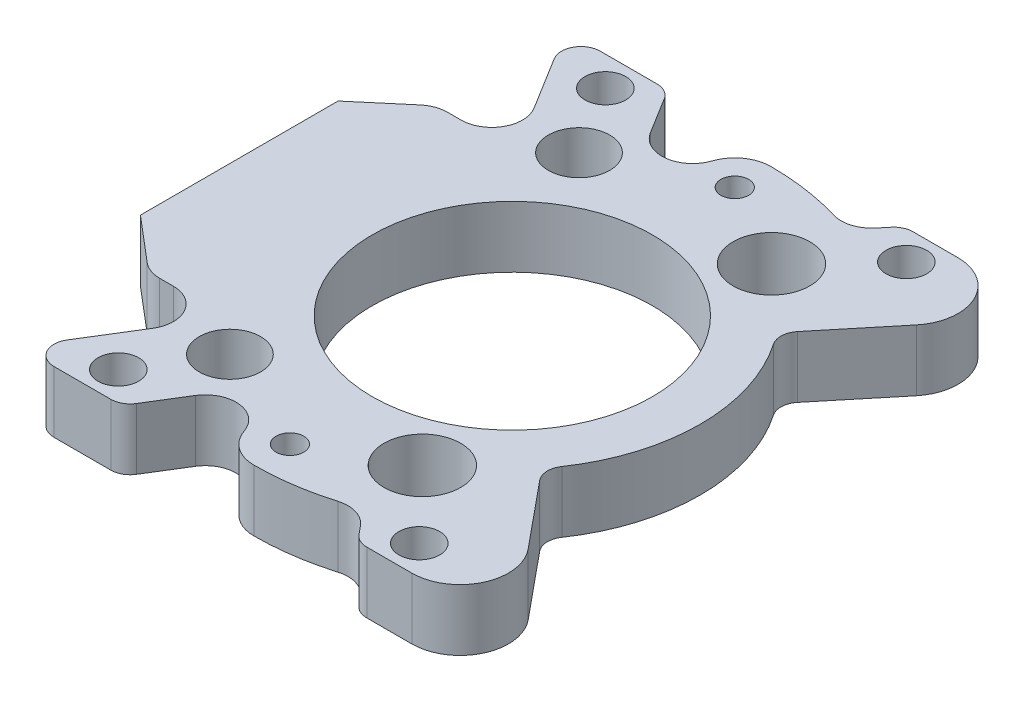
from build123d import *

# Parameters (mm, degrees)
SKETCH1_W           = 56.515
SKETCH1_H           = 56.515
SKETCH1_R           = 2.1082
SKETCH1_R_2         = 14.5
BOSS_EXTRUDE1_DEPTH = 6.35
SKETCH3_R           = 1.435
SKETCH3_R_2         = 3.96875
SKETCH3_R_3         = 3.175
CUT_EXTRUDE1_DEPTH  = 81.176137036
FILLET1_R           = 2


with BuildPart() as part:
    # Sketch1 → Boss-Extrude1 (new body)
    with BuildSketch(Plane(origin=(0, 0, 0), x_dir=(1, 0, 0), z_dir=(0, 1, 0))):
        with Locations((28.2575, 28.2575)):
            Rectangle(SKETCH1_W, SKETCH1_H)
        with Locations(Location((43.8277, 3.0607, 0), (0, 0, 270))):
            Circle(SKETCH1_R, mode=Mode.SUBTRACT)
        with Locations(Location((12.6873, 3.0607, 0), (0, 0, 270))):
            Circle(SKETCH1_R, mode=Mode.SUBTRACT)
        with Locations(Location((12.6873, 53.4543, 0), (0, 0, 270))):
            Circle(SKETCH1_R, mode=Mode.SUBTRACT)
        with Locations(Location((43.8277, 53.4543, 0), (0, 0, 270))):
            Circle(SKETCH1_R, mode=Mode.SUBTRACT)
        with Locations(Location((28.2575, 28.2575, 0), (0, 0, 270))):
            Circle(SKETCH1_R_2, mode=Mode.SUBTRACT)
    extrude(amount=BOSS_EXTRUDE1_DEPTH)

    # Sketch3 → Cut-Extrude1 (cut, through all)
    with BuildSketch(Plane(origin=(0, 6.35, 0), x_dir=(1, 0, 0), z_dir=(0, 1, 0))):
        with BuildLine():
            Line((16.085813501, 0), (40.518749208, 0))
            Line((40.518749208, 0), (39.213305633, 1.585036242))
            ThreePointArc((39.213305633, 1.585036242), (37.691149508, 2.60271564), (35.860147574, 2.610623974))
            ThreePointArc((35.860147574, 2.610623974), (32.098630453, 1.784717433), (28.2575, 1.5075))
            ThreePointArc((28.2575, 1.5075), (26.074260862, 2.211458651), (24.713448522, 4.058153181))
            ThreePointArc((24.713448522, 4.058153181), (22.067676274, 6.203891014), (19.001857165, 4.718948313))
            Line((19.001857165, 4.718948313), (16.085813501, 0))
        make_face()
        with BuildLine():
            ThreePointArc((49.976496805, 8.178709811), (50.638799533, 2.866171171), (46.116988554, 0))
            Line((46.116988554, 0), (56.515, 0))
            Line((56.515, 0), (56.515, 56.515))
            Line((56.515, 56.515), (46.116988554, 56.515))
            ThreePointArc((46.116988554, 56.515), (50.638799533, 53.648828829), (49.976496805, 48.336290189))
            Line((49.976496805, 48.336290189), (44.431541374, 41.603746953))
            ThreePointArc((44.431541374, 41.603746953), (43.977403924, 40.422997575), (44.322647522, 39.20594508))
            ThreePointArc((44.322647522, 39.20594508), (47.698626885, 28.2575), (44.322647522, 17.30905492))
            ThreePointArc((44.322647522, 17.30905492), (43.977403924, 16.092002425), (44.431541374, 14.911253047))
            Line((44.431541374, 14.911253047), (49.976496805, 8.178709811))
        make_face()
        with BuildLine():
            Line((0, 0), (5.506106862, 0))
            Line((5.506106862, 0), (10.776226353, 8.52848048))
            ThreePointArc((10.776226353, 8.52848048), (10.848364266, 11.743703095), (8.0753008, 13.3725))
            Line((8.0753008, 13.3725), (6.662712379, 13.3725))
            ThreePointArc((6.662712379, 13.3725), (5.569380258, 13.566686374), (4.609786847, 14.125492205))
            Line((4.609786847, 14.125492205), (0, 18.032807917))
            Line((0, 18.032807917), (0, 0))
        make_face()
        with BuildLine():
            Line((39.213305633, 54.929963758), (40.518749208, 56.515))
            Line((40.518749208, 56.515), (16.085813501, 56.515))
            Line((16.085813501, 56.515), (19.001857165, 51.796051687))
            ThreePointArc((19.001857165, 51.796051687), (22.067676274, 50.311108986), (24.713448522, 52.456846819))
            ThreePointArc((24.713448522, 52.456846819), (26.074260862, 54.303541349), (28.2575, 55.0075))
            ThreePointArc((28.2575, 55.0075), (32.098630453, 54.730282567), (35.860147574, 53.904376026))
            ThreePointArc((35.860147574, 53.904376026), (37.691149508, 53.91228436), (39.213305633, 54.929963758))
        make_face()
        with BuildLine():
            Line((10.776226353, 47.98651952), (5.506106862, 56.515))
            Line((5.506106862, 56.515), (0, 56.515))
            Line((0, 56.515), (0, 38.482192083))
            Line((0, 38.482192083), (4.609786847, 42.389507795))
            ThreePointArc((4.609786847, 42.389507795), (5.569380258, 42.948313626), (6.662712379, 43.1425))
            Line((6.662712379, 43.1425), (8.0753008, 43.1425))
            ThreePointArc((8.0753008, 43.1425), (10.848364266, 44.771296905), (10.776226353, 47.98651952))
        make_face()
        with Locations(Location((28.2575, 51.27, 0), (0, 0, 270))):
            Circle(SKETCH3_R)
        with Locations(Location((28.2575, 5.245, 0), (0, 0, 270))):
            Circle(SKETCH3_R)
        with Locations(Location((37.008353254, 10.1975, 0), (0, 0, 270))):
            Circle(SKETCH3_R_2)
        with Locations(Location((17.097439516, 10.1975, 0), (0, 0, 270))):
            Circle(SKETCH3_R_3)
        with Locations(Location((17.097439516, 46.3175, 0), (0, 0, 270))):
            Circle(SKETCH3_R_3)
        with Locations(Location((37.008353254, 46.3175, 0), (0, 0, 270))):
            Circle(SKETCH3_R_2)
    extrude(amount=-CUT_EXTRUDE1_DEPTH, mode=Mode.SUBTRACT)

    # Fillet1
    fillet1_edges = [part.edges().sort_by_distance(p)[0] for p in [
        (40.518749208, 3.175, 0),
        (16.085813501, 3.175, 0),
        (5.506106862, 3.175, 0),
        (5.506106862, 3.175, -56.515),
        (16.085813501, 3.175, -56.515),
        (40.518749208, 3.175, -56.515),
    ]]
    fillet(fillet1_edges, radius=FILLET1_R)


solid = part.part
